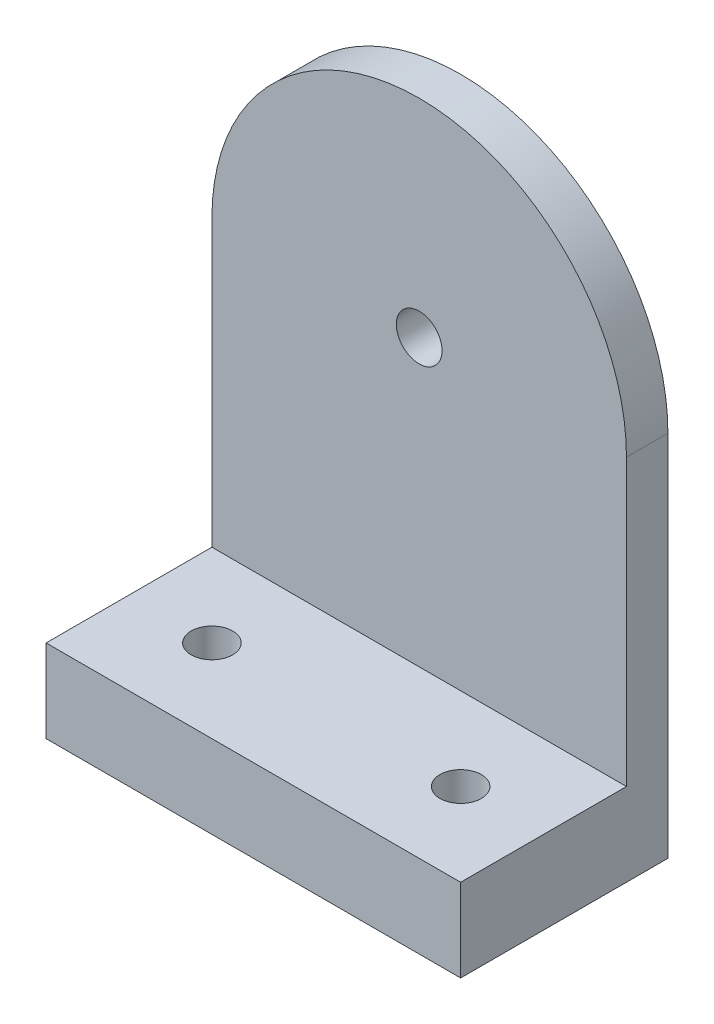
from build123d import *

# Parameters (mm, degrees)
BOSS_EXTRUDE1_DEPTH = 3.175
SKETCH4_W           = 31.75
SKETCH4_H           = 6.35
BOSS_EXTRUDE2_DEPTH = 12.7
SKETCH5_R           = 1.5875
CUT_EXTRUDE2_DEPTH  = 44.894808474
SKETCH6_R           = 1.75
CUT_EXTRUDE3_DEPTH  = 35.759275899


with BuildPart() as part:
    # Sketch1 → Boss-Extrude1 (new body)
    with BuildSketch(Plane.XY):
        with BuildLine():
            ThreePointArc((15.875, 0), (0, 15.875), (-15.875, 0))
            Line((-15.875, 0), (15.875, 0))
        make_face()
        with BuildLine():
            ThreePointArc((15.875, 0), (0, -15.875), (-15.875, 0))
            Line((-15.875, 0), (-15.875, -28.194))
            Line((-15.875, -28.194), (15.875, -28.194))
            Line((15.875, -28.194), (15.875, 0))
        make_face()
        with BuildLine():
            Line((15.875, 0), (-15.875, 0))
            ThreePointArc((-15.875, 0), (0, -15.875), (15.875, 0))
        make_face()
    extrude(amount=BOSS_EXTRUDE1_DEPTH)

    # Sketch4 → Boss-Extrude2 (add)
    with BuildSketch(Plane.XY.offset(3.175)):
        with Locations((0, -25.019)):
            Rectangle(SKETCH4_W, SKETCH4_H)
    extrude(amount=BOSS_EXTRUDE2_DEPTH)

    # Sketch5 → Cut-Extrude2 (cut, through all)
    with BuildSketch(Plane(origin=(0, -21.844, 0), x_dir=(1, 0, 0), z_dir=(0, 1, 0))):
        with Locations(Location((-9.525, -9.525, 0), (0, 0, 270))):
            Circle(SKETCH5_R)
        with Locations(Location((9.525, -9.525, 0), (0, 0, 90))):
            Circle(SKETCH5_R)
    extrude(amount=-CUT_EXTRUDE2_DEPTH, mode=Mode.SUBTRACT)

    # Sketch6 → Cut-Extrude3 (cut, through all)
    with BuildSketch(Plane.XY.offset(3.175)):
        Circle(SKETCH6_R)
    extrude(amount=-CUT_EXTRUDE3_DEPTH, mode=Mode.SUBTRACT)


solid = part.part
